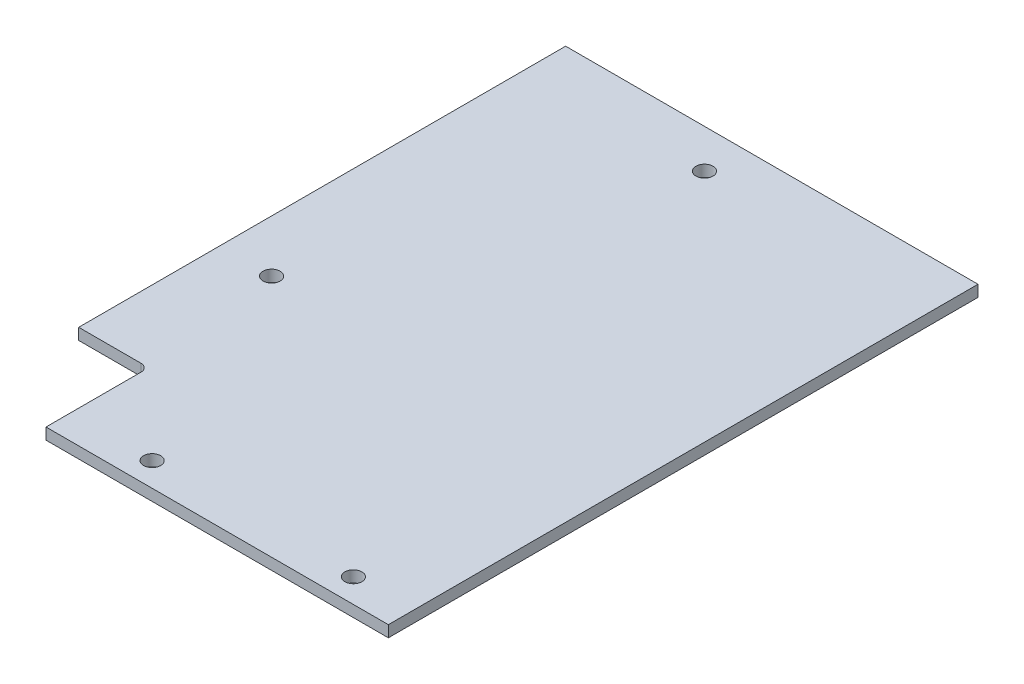
from build123d import *

# Parameters (mm, degrees)
BOSS_EXTRUDE1_DEPTH = 3
SKETCH2_R           = 2.25
CUT_EXTRUDE1_DEPTH  = 190.168073416
FILLET1_R           = 2


with BuildPart() as part:
    # Sketch1 → Boss-Extrude1 (new body)
    with BuildSketch(Plane(origin=(0, 0, 0), x_dir=(1, 0, 0), z_dir=(0, 1, 0))):
        Polygon((0, 0), (0, -155), (-90, -155), (-90, -128), (-108.4, -128), (-108.4, 0), align=None)
    extrude(amount=BOSS_EXTRUDE1_DEPTH)

    # Sketch2 → Cut-Extrude1 (cut, through all)
    with BuildSketch(Plane(origin=(0, 3, 0), x_dir=(1, 0, 0), z_dir=(0, 1, 0))):
        with Locations(Location((-68.4, -148.7, 0), (0, 0, 270))):
            Circle(SKETCH2_R)
        with Locations(Location((-15.5, -148.7, 0), (0, 0, 270))):
            Circle(SKETCH2_R)
        with Locations(Location((-94.7, -91, 0), (0, 0, 270))):
            Circle(SKETCH2_R)
        with Locations(Location((-61.7, -10.2, 0), (0, 0, 270))):
            Circle(SKETCH2_R)
    extrude(amount=-CUT_EXTRUDE1_DEPTH, mode=Mode.SUBTRACT)

    # Fillet1
    fillet1_edges = [part.edges().sort_by_distance(p)[0] for p in [
        (-90, 1.5, 128),
    ]]
    fillet(fillet1_edges, radius=FILLET1_R)


solid = part.part
